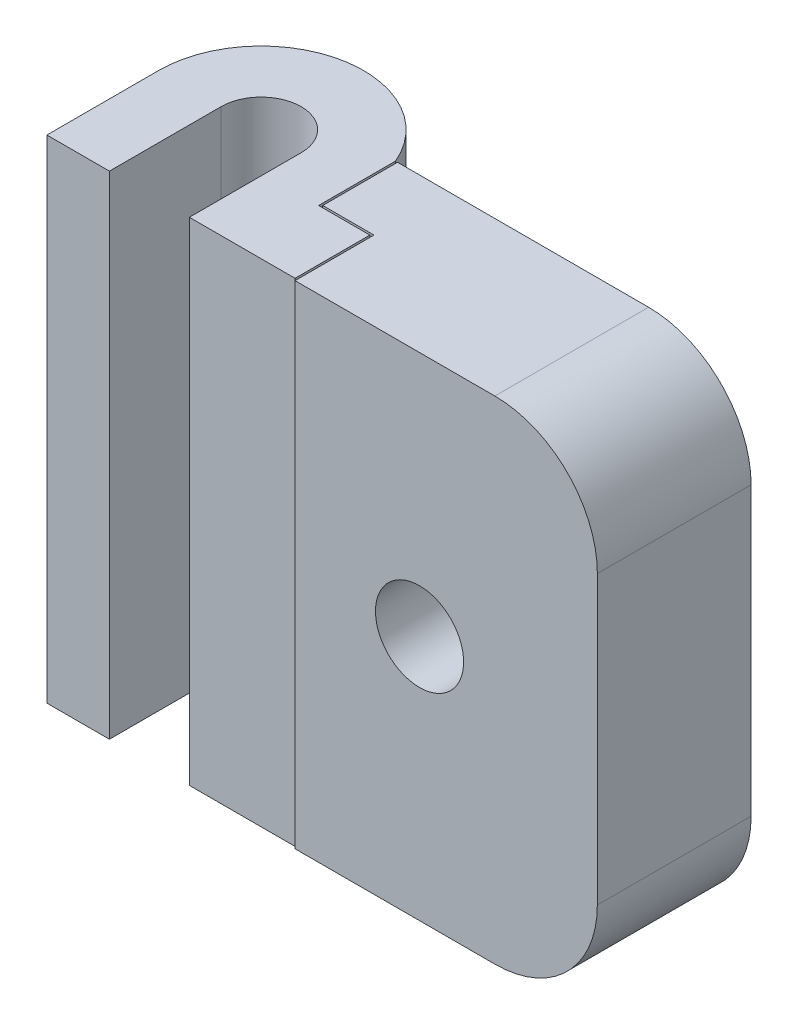
from build123d import *

# Parameters (mm, degrees)
BOSS_EXTRUDE3_DEPTH = 24
FILLET1_R           = 5
SKETCH10_R          = 4.1
CUT_EXTRUDE3_DEPTH  = 3
SKETCH11_R          = 2.15
CUT_EXTRUDE4_DEPTH  = 34.081792575
CUT_EXTRUDE5_DEPTH  = 33.994014609
SKETCH14_W          = 5.154074283
SKETCH14_H          = 24
SKETCH14_W_2        = 3.05
CUT_EXTRUDE6_DEPTH  = 0.1
SKETCH15_R          = 2.15
BOSS_EXTRUDE4_DEPTH = 0.6


with BuildPart() as part:
    # Sketch4 → Boss-Extrude3 (new body)
    with BuildSketch(Plane(origin=(0, 0, 0), x_dir=(1, 0, 0), z_dir=(0, 1, 0))):
        with BuildLine():
            Line((21.95, 0), (21.95, 1.95))
            Line((21.95, 1.95), (4.604074283, 1.95))
            ThreePointArc((4.604074283, 1.95), (-0.994894112, 4.90001895), (-5, 0))
            Line((-5, 0), (-5, -5.55))
            Line((-5, -5.55), (-1.95, -5.55))
            Line((-1.95, -5.55), (-1.95, 0))
            ThreePointArc((-1.95, 0), (0, 1.95), (1.95, 0))
            Line((1.95, 0), (1.95, -5.55))
            Line((1.95, -5.55), (21.95, -5.55))
            Line((21.95, -5.55), (21.95, 0))
        make_face()
    extrude(amount=BOSS_EXTRUDE3_DEPTH)

    # Fillet1
    fillet1_edges = [part.edges().sort_by_distance(p)[0] for p in [
        (21.95, 0, 1.8),
        (21.95, 24, 1.8),
    ]]
    fillet(fillet1_edges, radius=FILLET1_R)

    # Sketch10 → Cut-Extrude3 (cut)
    with BuildSketch(Plane(origin=(0, 0, -1.95), x_dir=(-1, 0, 0), z_dir=(0, 0, -1))):
        with Locations((-13.277037141, 12)):
            Circle(SKETCH10_R)
    extrude(amount=-CUT_EXTRUDE3_DEPTH, mode=Mode.SUBTRACT)

    # Sketch11 → Cut-Extrude4 (cut, through all)
    with BuildSketch(Plane(origin=(0, 0, 1.05), x_dir=(-1, 0, 0), z_dir=(0, 0, -1))):
        with Locations((-13.277037141, 12)):
            Circle(SKETCH11_R)
    extrude(amount=-CUT_EXTRUDE4_DEPTH, mode=Mode.SUBTRACT)

    # Sketch13 → Cut-Extrude5 (cut, through all)
    with BuildSketch(Plane.XZ):
        Polygon((4.604074283, -1.95), (4.604074283, 1.8), (7.104074283, 1.8), (7.104074283, 5.55), (7.204074283, 5.55), (7.204074283, 1.7), (4.704074283, 1.7), (4.704074283, -1.95), align=None)
    extrude(amount=-CUT_EXTRUDE5_DEPTH, mode=Mode.SUBTRACT)


with BuildPart() as cut_extrude5_piece_1:
    # of the separate pieces the step leaves, piece 1, a body of its own (cut_extrude5_pieces)
    add(part.part.solids().sort_by_distance((21.95, 5, -1.95))[0])

    # Sketch15 → Boss-Extrude4 (add)
    with BuildSketch(Plane(origin=(0, 0, 1.05), x_dir=(-1, 0, 0), z_dir=(0, 0, -1))):
        with Locations((-13.277037141, 12)):
            Circle(SKETCH15_R)
    extrude(amount=-BOSS_EXTRUDE4_DEPTH)


with BuildPart() as cut_extrude5_piece_2:
    # of the separate pieces the step leaves, piece 2, a body of its own (cut_extrude5_pieces)
    add(part.part.solids().sort_by_distance((4.604074283, 0, -1.95))[0])

    # Sketch14 → Cut-Extrude6 (cut)
    with BuildSketch(Plane.XY.offset(5.55)):
        with Locations((4.527037142, 12)):
            Rectangle(SKETCH14_W, SKETCH14_H)
        with Locations((-3.475, 12)):
            Rectangle(SKETCH14_W_2, SKETCH14_H)
    extrude(amount=-CUT_EXTRUDE6_DEPTH, mode=Mode.SUBTRACT)


solid = Compound([cut_extrude5_piece_1.part, cut_extrude5_piece_2.part])
